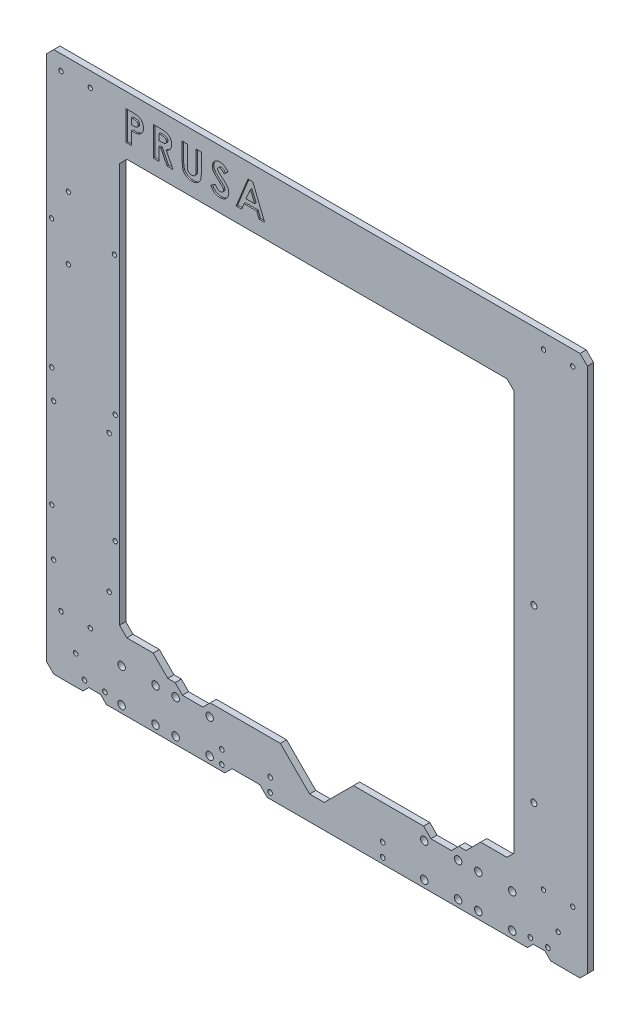
from build123d import *

# Parameters (mm, degrees)
SKETCH1_R           = 2.55
SKETCH1_R_2         = 1.5
SKETCH1_R_3         = 1.6
SKETCH1_R_4         = 2.1
BOSS_EXTRUDE1_DEPTH = 4.25
CUT_EXTRUDE1_DEPTH  = 1


with BuildPart() as part:
    # Sketch1 → Boss-Extrude1 (new body)
    with BuildSketch(Plane.XY):
        with BuildLine():
            add(Edge.make_bspline(
                [(5, 370), (2.5, 367.5), (0, 365)],
                knots=[1472.868668236, 1472.868668236, 1472.868668236, 1479.939736048, 1479.939736048, 1479.939736048], degree=2))
            add(Edge.make_bspline(
                [(0, 365), (0, 185), (0, 5)],
                knots=[0, 0, 0, 360.191742, 360.191742, 360.191742], degree=2))
            add(Edge.make_bspline(
                [(0, 5), (2.5, 2.5), (5, 0)],
                knots=[360.191742, 360.191742, 360.191742, 367.128552866, 367.128552866, 367.128552866], degree=2))
            add(Edge.make_bspline(
                [(5, 0), (15, 0), (25, 0)],
                knots=[367.128552866, 367.128552866, 367.128552866, 387.128552866, 387.128552866, 387.128552866], degree=2))
            add(Edge.make_bspline(
                [(25, 0), (27, 2), (29, 4)],
                knots=[387.128552866, 387.128552866, 387.128552866, 395.613834241, 395.613834241, 395.613834241], degree=2))
            add(Edge.make_bspline(
                [(29, 4), (33, 4), (37, 4)],
                knots=[395.613834241, 395.613834241, 395.613834241, 401.613834241, 401.613834241, 401.613834241], degree=2))
            add(Edge.make_bspline(
                [(37, 4), (39, 2), (41, 0)],
                knots=[401.613834241, 401.613834241, 401.613834241, 407.27068849, 407.27068849, 407.27068849], degree=2))
            add(Edge.make_bspline(
                [(41, 0), (81.5, 0), (122, 0)],
                knots=[407.27068849, 407.27068849, 407.27068849, 482.27068849, 482.27068849, 482.27068849], degree=2))
            add(Edge.make_bspline(
                [(122, 0), (124.5, 2.5), (127, 5)],
                knots=[482.27068849, 482.27068849, 482.27068849, 487.92754274, 487.92754274, 487.92754274], degree=2))
            add(Edge.make_bspline(
                [(127, 5), (136.5, 5), (146, 5)],
                knots=[487.92754274, 487.92754274, 487.92754274, 501.92754274, 501.92754274, 501.92754274], degree=2))
            add(Edge.make_bspline(
                [(146, 5), (148.5, 2.5), (151, 0)],
                knots=[501.92754274, 501.92754274, 501.92754274, 507.584396989, 507.584396989, 507.584396989], degree=2))
            add(Edge.make_bspline(
                [(151, 0), (240, 0), (329, 0)],
                knots=[507.584396989, 507.584396989, 507.584396989, 698.584396989, 698.584396989, 698.584396989], degree=2))
            add(Edge.make_bspline(
                [(329, 0), (331, 2), (333, 4)],
                knots=[698.584396989, 698.584396989, 698.584396989, 704.241251238, 704.241251238, 704.241251238], degree=2))
            add(Edge.make_bspline(
                [(333, 4), (337, 4), (341, 4)],
                knots=[704.241251238, 704.241251238, 704.241251238, 710.241251238, 710.241251238, 710.241251238], degree=2))
            add(Edge.make_bspline(
                [(341, 4), (343, 2), (345, 0)],
                knots=[710.241251238, 710.241251238, 710.241251238, 718.726532613, 718.726532613, 718.726532613], degree=2))
            add(Edge.make_bspline(
                [(345, 0), (355, 0), (365, 0)],
                knots=[718.726532613, 718.726532613, 718.726532613, 738.726532613, 738.726532613, 738.726532613], degree=2))
            add(Edge.make_bspline(
                [(365, 0), (367.5, 2.5), (370, 5)],
                knots=[738.726532613, 738.726532613, 738.726532613, 745.797600425, 745.797600425, 745.797600425], degree=2))
            add(Edge.make_bspline(
                [(370, 5), (370, 185), (370, 365)],
                knots=[745.797600425, 745.797600425, 745.797600425, 1105.797600425, 1105.797600425, 1105.797600425], degree=2))
            add(Edge.make_bspline(
                [(370, 365), (367.5, 367.5), (365, 370)],
                knots=[1105.797600425, 1105.797600425, 1105.797600425, 1112.868668236, 1112.868668236, 1112.868668236], degree=2))
            add(Edge.make_bspline(
                [(365, 370), (185, 370), (5, 370)],
                knots=[1112.868668236, 1112.868668236, 1112.868668236, 1472.868668236, 1472.868668236, 1472.868668236], degree=2))
        make_face()
        with Locations((318.6, 4.9)):
            Circle(SKETCH1_R, mode=Mode.SUBTRACT)
        with Locations((318.6, 28.1)):
            Circle(SKETCH1_R, mode=Mode.SUBTRACT)
        with Locations((295.4, 28.1)):
            Circle(SKETCH1_R, mode=Mode.SUBTRACT)
        with Locations((295.4, 4.9)):
            Circle(SKETCH1_R, mode=Mode.SUBTRACT)
        with Locations((281.6, 4.9)):
            Circle(SKETCH1_R, mode=Mode.SUBTRACT)
        with Locations((258.4, 4.9)):
            Circle(SKETCH1_R, mode=Mode.SUBTRACT)
        with Locations((258.4, 28.1)):
            Circle(SKETCH1_R, mode=Mode.SUBTRACT)
        with Locations((281.6, 28.1)):
            Circle(SKETCH1_R, mode=Mode.SUBTRACT)
        with Locations((111.6, 4.9)):
            Circle(SKETCH1_R, mode=Mode.SUBTRACT)
        with Locations((111.6, 28.1)):
            Circle(SKETCH1_R, mode=Mode.SUBTRACT)
        with Locations((88.4, 28.1)):
            Circle(SKETCH1_R, mode=Mode.SUBTRACT)
        with Locations((88.4, 4.9)):
            Circle(SKETCH1_R, mode=Mode.SUBTRACT)
        with Locations((74.6, 4.9)):
            Circle(SKETCH1_R, mode=Mode.SUBTRACT)
        with Locations((74.6, 28.1)):
            Circle(SKETCH1_R, mode=Mode.SUBTRACT)
        with Locations((51.4, 28.1)):
            Circle(SKETCH1_R, mode=Mode.SUBTRACT)
        with Locations((51.4, 4.9)):
            Circle(SKETCH1_R, mode=Mode.SUBTRACT)
        with Locations((360, 39.8)):
            Circle(SKETCH1_R_2, mode=Mode.SUBTRACT)
        with Locations((10, 39.8)):
            Circle(SKETCH1_R_2, mode=Mode.SUBTRACT)
        with Locations((340, 359.8)):
            Circle(SKETCH1_R_2, mode=Mode.SUBTRACT)
        with Locations((30, 39.8)):
            Circle(SKETCH1_R_2, mode=Mode.SUBTRACT)
        with Locations((42.9, 67.8)):
            Circle(SKETCH1_R_2, mode=Mode.SUBTRACT)
        with Locations((340, 39.8)):
            Circle(SKETCH1_R_2, mode=Mode.SUBTRACT)
        with Locations((10, 359.8)):
            Circle(SKETCH1_R_2, mode=Mode.SUBTRACT)
        with Locations((350, 19.8)):
            Circle(SKETCH1_R_2, mode=Mode.SUBTRACT)
        with Locations((47, 99.8)):
            Circle(SKETCH1_R_2, mode=Mode.SUBTRACT)
        with Locations((3.7, 181.1)):
            Circle(SKETCH1_R_2, mode=Mode.SUBTRACT)
        with Locations((20, 19.8)):
            Circle(SKETCH1_R_2, mode=Mode.SUBTRACT)
        with Locations((4.9, 67.8)):
            Circle(SKETCH1_R_2, mode=Mode.SUBTRACT)
        with Locations((360, 359.8)):
            Circle(SKETCH1_R_2, mode=Mode.SUBTRACT)
        with Locations((42.9, 161.8)):
            Circle(SKETCH1_R_2, mode=Mode.SUBTRACT)
        with Locations((3.7, 99.8)):
            Circle(SKETCH1_R_2, mode=Mode.SUBTRACT)
        with Locations((30, 359.8)):
            Circle(SKETCH1_R_2, mode=Mode.SUBTRACT)
        with Locations((47, 174.7)):
            Circle(SKETCH1_R_2, mode=Mode.SUBTRACT)
        with Locations((4.9, 161.8)):
            Circle(SKETCH1_R_2, mode=Mode.SUBTRACT)
        with Locations((46.5, 269.3)):
            Circle(SKETCH1_R_2, mode=Mode.SUBTRACT)
        with Locations((15, 247.8)):
            Circle(SKETCH1_R_2, mode=Mode.SUBTRACT)
        with Locations((3.5, 269.3)):
            Circle(SKETCH1_R_2, mode=Mode.SUBTRACT)
        with Locations((15, 290.8)):
            Circle(SKETCH1_R_2, mode=Mode.SUBTRACT)
        with Locations((40, 7)):
            Circle(SKETCH1_R_3, mode=Mode.SUBTRACT)
        with Locations((331, 7)):
            Circle(SKETCH1_R_3, mode=Mode.SUBTRACT)
        with Locations((343, 7)):
            Circle(SKETCH1_R_3, mode=Mode.SUBTRACT)
        with Locations((120, 13)):
            Circle(SKETCH1_R_3, mode=Mode.SUBTRACT)
        with Locations((120, 4)):
            Circle(SKETCH1_R_3, mode=Mode.SUBTRACT)
        with Locations((230, 13)):
            Circle(SKETCH1_R_3, mode=Mode.SUBTRACT)
        with Locations((230, 4)):
            Circle(SKETCH1_R_3, mode=Mode.SUBTRACT)
        with Locations((333.4, 205)):
            Circle(SKETCH1_R_4, mode=Mode.SUBTRACT)
        with Locations((333.4, 88)):
            Circle(SKETCH1_R_4, mode=Mode.SUBTRACT)
        with Locations((26, 7)):
            Circle(SKETCH1_R_3, mode=Mode.SUBTRACT)
        with Locations((153, 13)):
            Circle(SKETCH1_R_3, mode=Mode.SUBTRACT)
        with Locations((153, 4)):
            Circle(SKETCH1_R_3, mode=Mode.SUBTRACT)
        with BuildLine():
            add(Edge.make_bspline(
                [(93, 31.5), (100, 31.5), (107, 31.5)],
                knots=[1110.421356237, 1110.421356237, 1110.421356237, 1117.046356237, 1117.046356237, 1117.046356237], degree=2))
            add(Edge.make_bspline(
                [(107, 31.5), (109.5, 34), (112, 36.5)],
                knots=[0, 0, 0, 7.071067812, 7.071067812, 7.071067812], degree=2))
            add(Edge.make_bspline(
                [(112, 36.5), (134.25, 36.5), (156.5, 36.5), (158.25, 36.5), (160, 36.5)],
                knots=[7.071067812, 7.071067812, 7.071067812, 51.571067812, 51.571067812, 55.071067812, 55.071067812, 55.071067812], degree=2))
            add(Edge.make_bspline(
                [(160, 36.5), (170, 26.5), (180, 16.5)],
                knots=[55.071067812, 55.071067812, 55.071067812, 83.355339059, 83.355339059, 83.355339059], degree=2))
            add(Edge.make_bspline(
                [(180, 16.5), (185, 16.5), (190, 16.5)],
                knots=[83.355339059, 83.355339059, 83.355339059, 93.355339059, 93.355339059, 93.355339059], degree=2))
            add(Edge.make_bspline(
                [(190, 16.5), (200, 26.5), (210, 36.5)],
                knots=[93.355339059, 93.355339059, 93.355339059, 121.639610307, 121.639610307, 121.639610307], degree=2))
            add(Edge.make_bspline(
                [(210, 36.5), (211.75, 36.5), (213.5, 36.5), (235.75, 36.5), (258, 36.5)],
                knots=[121.639610307, 121.639610307, 121.639610307, 125.139610307, 125.139610307, 169.639610307, 169.639610307, 169.639610307], degree=2))
            add(Edge.make_bspline(
                [(258, 36.5), (260.5, 34), (263, 31.5)],
                knots=[169.639610307, 169.639610307, 169.639610307, 176.710678119, 176.710678119, 176.710678119], degree=2))
            add(Edge.make_bspline(
                [(263, 31.5), (264, 31.5), (265, 31.5), (270, 31.5), (275, 31.5), (276, 31.5), (277, 31.5)],
                knots=[176.710678119, 176.710678119, 176.710678119, 178.710678119, 178.710678119, 188.710678119, 188.710678119, 190.710678119, 190.710678119, 190.710678119], degree=2))
            add(Edge.make_bspline(
                [(277, 31.5), (279.5, 34), (282, 36.5)],
                knots=[190.710678119, 190.710678119, 190.710678119, 197.781745931, 197.781745931, 197.781745931], degree=2))
            add(Edge.make_bspline(
                [(282, 36.5), (284.5, 36.5), (287, 36.5)],
                knots=[197.781745931, 197.781745931, 197.781745931, 202.781745931, 202.781745931, 202.781745931], degree=2))
            add(Edge.make_bspline(
                [(287, 36.5), (292, 41.5), (297, 46.5)],
                knots=[202.781745931, 202.781745931, 202.781745931, 216.923881554, 216.923881554, 216.923881554], degree=2))
            add(Edge.make_bspline(
                [(297, 46.5), (306, 46.5), (315, 46.5)],
                knots=[216.923881554, 216.923881554, 216.923881554, 234.923881554, 234.923881554, 234.923881554], degree=2))
            add(Edge.make_bspline(
                [(315, 46.5), (317.5, 49), (320, 51.5)],
                knots=[234.923881554, 234.923881554, 234.923881554, 241.994949366, 241.994949366, 241.994949366], degree=2))
            add(Edge.make_bspline(
                [(320, 51.5), (320, 188.25), (320, 325)],
                knots=[241.994949366, 241.994949366, 241.994949366, 513.494949366, 513.494949366, 513.494949366], degree=2))
            add(Edge.make_bspline(
                [(320, 325), (317.5, 327.5), (315, 330)],
                knots=[513.494949366, 513.494949366, 513.494949366, 520.566017178, 520.566017178, 520.566017178], degree=2))
            add(Edge.make_bspline(
                [(315, 330), (185, 330), (55, 330)],
                knots=[520.566017178, 520.566017178, 520.566017178, 780.566017178, 780.566017178, 780.566017178], degree=2))
            add(Edge.make_bspline(
                [(55, 330), (52.5, 327.5), (50, 325)],
                knots=[780.566017178, 780.566017178, 780.566017178, 787.63708499, 787.63708499, 787.63708499], degree=2))
            add(Edge.make_bspline(
                [(50, 325), (50, 188.25), (50, 51.5)],
                knots=[787.63708499, 787.63708499, 787.63708499, 1059.13708499, 1059.13708499, 1059.13708499], degree=2))
            add(Edge.make_bspline(
                [(50, 51.5), (52.5, 49), (55, 46.5)],
                knots=[1059.13708499, 1059.13708499, 1059.13708499, 1066.208152802, 1066.208152802, 1066.208152802], degree=2))
            add(Edge.make_bspline(
                [(55, 46.5), (64, 46.5), (73, 46.5)],
                knots=[1066.208152802, 1066.208152802, 1066.208152802, 1084.208152802, 1084.208152802, 1084.208152802], degree=2))
            add(Edge.make_bspline(
                [(73, 46.5), (78, 41.5), (83, 36.5)],
                knots=[1084.208152802, 1084.208152802, 1084.208152802, 1098.350288425, 1098.350288425, 1098.350288425], degree=2))
            add(Edge.make_bspline(
                [(83, 36.5), (85.5, 36.5), (88, 36.5)],
                knots=[1098.350288425, 1098.350288425, 1098.350288425, 1103.350288425, 1103.350288425, 1103.350288425], degree=2))
            add(Edge.make_bspline(
                [(88, 36.5), (90.5, 34), (93, 31.5)],
                knots=[1103.350288425, 1103.350288425, 1103.350288425, 1110.421356237, 1110.421356237, 1110.421356237], degree=2))
        make_face(mode=Mode.SUBTRACT)
    extrude(amount=BOSS_EXTRUDE1_DEPTH)

    # Sketch2 → Cut-Extrude1 (cut)
    # profile 1 of 5: a face of its own
    with BuildSketch(Plane.XY.offset(4.25)):
        with BuildLine():
            Line((54.564407773, 359.746059065), (58.57081803, 359.746059065))
            add(Edge.make_bspline(
                [(58.57081803, 359.746059065), (58.832591679, 359.744887311), (59.337607918, 359.742626751), (60.065882885, 359.715214451), (60.7377522, 359.666089942), (61.353061503, 359.605379816), (61.911557793, 359.520266583), (62.413940476, 359.422690925), (62.860313807, 359.303815374), (63.25571131, 359.162711743), (63.610567798, 358.996356076), (63.946376486, 358.819175415), (64.255548063, 358.607716545), (64.553687352, 358.384769606), (64.823749214, 358.129036561), (65.082581726, 357.857536815), (65.319222626, 357.559502914), (65.534768419, 357.238542475), (65.730301665, 356.900585477), (65.901132591, 356.545027751), (66.039701071, 356.171306666), (66.155942795, 355.781839771), (66.249309281, 355.376644041), (66.311456986, 354.953227485), (66.353670833, 354.51454656), (66.357395623, 354.215980045), (66.359279568, 354.064969322)],
                knots=[0, 0, 0, 0, 1.698747864, 3.27724071, 4.728299578, 6.070144658, 7.288476769, 8.393259625, 9.389771311, 10.283485332, 11.113357557, 11.931608583, 12.74405601, 13.541433047, 14.344816069, 15.154114104, 15.974336324, 16.810834471, 17.661136416, 18.50621059, 19.367396281, 20.244825668, 21.142564693, 22.063065223, 23.020325768, 24, 24, 24, 24], degree=3))
            add(Edge.make_bspline(
                [(66.359279568, 354.064969322), (66.356553735, 353.897909754), (66.351197137, 353.569617176), (66.298685215, 353.088380532), (66.208978262, 352.629564962), (66.091735966, 352.189301194), (65.928249922, 351.774832541), (65.741474794, 351.376269654), (65.511682144, 351.004787013), (65.249107305, 350.655737818), (64.962345625, 350.326284134), (64.644589394, 350.025938314), (64.301895182, 349.752652909), (63.936246724, 349.503563869), (63.546271266, 349.27917366), (63.132250194, 349.077381106), (62.691356337, 348.904640161), (62.38433112, 348.814298045), (62.228670594, 348.768494963)],
                knots=[0, 0, 0, 0, 1.102006807, 2.165578795, 3.188629044, 4.184801286, 5.166646146, 6.124351954, 7.085497154, 8.042432466, 9.003981491, 9.963833307, 10.922997304, 11.89326795, 12.880200226, 13.889073926, 14.929769137, 16, 16, 16, 16], degree=3))
            add(Edge.make_bspline(
                [(62.228670594, 348.768494963), (62.126143617, 348.742986085), (61.90403717, 348.687725642), (61.536512005, 348.631622422), (61.112977841, 348.58003896), (60.632065114, 348.53570922), (60.093496568, 348.505575326), (59.497793676, 348.482042095), (58.844686477, 348.464931006), (58.390541557, 348.464323829), (58.154151363, 348.464007783)],
                knots=[0, 0, 0, 0, 0.618981996, 1.340914327, 2.176866532, 3.120127938, 4.170906482, 5.338178032, 6.614476169, 8, 8, 8, 8], degree=3))
            Line((58.154151363, 348.464007783), (58.154151363, 339.746059065))
            Line((58.154151363, 339.746059065), (54.564407773, 339.746059065))
            Line((54.564407773, 339.746059065), (54.564407773, 359.746059065))
        make_face()
        with BuildLine():
            Line((58.154151363, 352.053751373), (59.424183414, 352.053751373))
            add(Edge.make_bspline(
                [(59.424183414, 352.053751373), (59.655285797, 352.055216742), (60.080517614, 352.057913041), (60.661234114, 352.096903103), (61.127909063, 352.156448804), (61.496590939, 352.241851109), (61.787700201, 352.371460415), (62.038763713, 352.521393976), (62.254107297, 352.710980848), (62.440563146, 352.927616288), (62.589628978, 353.176541267), (62.692998368, 353.453702524), (62.760145092, 353.753276605), (62.766346715, 353.961760337), (62.769535979, 354.068975732)],
                knots=[0, 0, 0, 0, 1.8619151, 3.425951444, 4.686033666, 5.651700536, 6.461346321, 7.243864085, 7.999046032, 8.762387399, 9.539336099, 10.322741239, 11.137448474, 12, 12, 12, 12], degree=3))
            add(Edge.make_bspline(
                [(62.769535979, 354.068975732), (62.766379521, 354.162648427), (62.760255235, 354.344395977), (62.71526456, 354.606702771), (62.643562367, 354.851226815), (62.539668645, 355.075414379), (62.405358664, 355.278884532), (62.241607617, 355.46155712), (62.050516752, 355.62734423), (61.902983431, 355.71509788), (61.828029568, 355.75968086)],
                knots=[0, 0, 0, 0, 1.102301479, 2.1387299, 3.123554645, 4.094223062, 5.036071848, 5.982632524, 6.975082478, 8, 8, 8, 8], degree=3))
            add(Edge.make_bspline(
                [(61.828029568, 355.75968086), (61.76453932, 355.791789699), (61.630117453, 355.859770692), (61.401183982, 355.938803566), (61.136998252, 356.005476502), (60.835776712, 356.060814395), (60.498721021, 356.103762347), (60.125891316, 356.136606786), (59.716738942, 356.149814814), (59.432197947, 356.154088822), (59.283959055, 356.156315476)],
                knots=[0, 0, 0, 0, 0.656809284, 1.390599849, 2.23162475, 3.173112763, 4.218524733, 5.370385145, 6.63003504, 8, 8, 8, 8], degree=3))
            Line((59.283959055, 356.156315476), (58.154151363, 356.156315476))
            Line((58.154151363, 356.156315476), (58.154151363, 352.053751373))
        make_face(mode=Mode.SUBTRACT)
    # profile 2 of 5: a face of its own
    with BuildSketch(Plane.XY.offset(4.25)):
        with BuildLine():
            Line((73.333638543, 359.746059065), (77.51633085, 359.746059065))
            add(Edge.make_bspline(
                [(77.51633085, 359.746059065), (77.792805539, 359.745077739), (78.324544243, 359.743190372), (79.091282412, 359.713412716), (79.795636864, 359.671974665), (80.438650459, 359.608739098), (81.020048106, 359.52489638), (81.5404125, 359.42605969), (81.999728433, 359.313414092), (82.4018696, 359.173048789), (82.764782117, 359.014718855), (83.103067038, 358.832794858), (83.424187431, 358.629302579), (83.725996952, 358.398887586), (84.011118397, 358.145694986), (84.280089666, 357.869469917), (84.529109945, 357.567870105), (84.756637289, 357.242801277), (84.964010149, 356.900836323), (85.147284264, 356.541505726), (85.296323078, 356.164559592), (85.428014848, 355.77544561), (85.522868163, 355.368601318), (85.588837256, 354.947987415), (85.637137245, 354.512123294), (85.639914263, 354.216016563), (85.64133085, 354.064969322)],
                knots=[0, 0, 0, 0, 1.749336639, 3.364467119, 4.854658419, 6.213483162, 7.451590619, 8.570285859, 9.5643256, 10.440900261, 11.26203566, 12.067320669, 12.869050712, 13.665104639, 14.467235401, 15.27997916, 16.102287765, 16.939272006, 17.78853747, 18.631303466, 19.488103222, 20.351255419, 21.228522269, 22.127379805, 23.044756219, 24, 24, 24, 24], degree=3))
            add(Edge.make_bspline(
                [(85.64133085, 354.064969322), (85.637651066, 353.907310701), (85.630435681, 353.598170881), (85.591569689, 353.144069699), (85.520534866, 352.70961745), (85.412942291, 352.296086159), (85.289278601, 351.898328945), (85.124837616, 351.523684678), (84.939249711, 351.166704701), (84.718832378, 350.832438629), (84.476935124, 350.513461746), (84.195613706, 350.22199524), (83.89309343, 349.94237389), (83.552368531, 349.692112227), (83.188458477, 349.454288463), (82.794132761, 349.238756799), (82.371964885, 349.040099263), (82.075159962, 348.929314099), (81.923382132, 348.872661629)],
                knots=[0, 0, 0, 0, 1.099860209, 2.156625411, 3.176576793, 4.16617041, 5.135385252, 6.078461593, 7.016046972, 7.938469504, 8.868247731, 9.803980173, 10.76021508, 11.73834243, 12.748633912, 13.790971185, 14.870363756, 16, 16, 16, 16], degree=3))
            Line((81.923382132, 348.872661629), (86.538766748, 339.746059065))
            Line((86.538766748, 339.746059065), (82.548382132, 339.746059065))
            Line((82.548382132, 339.746059065), (78.14133085, 348.464007783))
            Line((78.14133085, 348.464007783), (76.923382132, 348.464007783))
            Line((76.923382132, 348.464007783), (76.923382132, 339.746059065))
            Line((76.923382132, 339.746059065), (73.333638543, 339.746059065))
            Line((73.333638543, 339.746059065), (73.333638543, 359.746059065))
        make_face()
        with BuildLine():
            Line((76.923382132, 352.053751373), (78.321619312, 352.053751373))
            add(Edge.make_bspline(
                [(78.321619312, 352.053751373), (78.49256543, 352.055676683), (78.819890514, 352.059363238), (79.290626977, 352.076463009), (79.718167949, 352.117665007), (80.104349437, 352.169722191), (80.451114671, 352.229829728), (80.755370626, 352.315967477), (81.021805424, 352.408266257), (81.2472618, 352.522969697), (81.439886548, 352.653412386), (81.606205689, 352.801598525), (81.743775466, 352.973105111), (81.857002409, 353.163271335), (81.945080661, 353.373779172), (82.009371037, 353.602317722), (82.04529985, 353.851490333), (82.049433583, 354.023453362), (82.051587261, 354.113046245)],
                knots=[0, 0, 0, 0, 1.688639943, 3.233382647, 4.650958383, 5.928841754, 7.082724185, 8.122798841, 9.049171256, 9.863274652, 10.613301712, 11.341792392, 12.054588806, 12.776240173, 13.521029143, 14.301969904, 15.115324896, 16, 16, 16, 16], degree=3))
            add(Edge.make_bspline(
                [(82.051587261, 354.113046245), (82.047515535, 354.219041166), (82.039517385, 354.427248546), (81.960150885, 354.726994166), (81.833816561, 355.004429246), (81.660646805, 355.258300265), (81.442562011, 355.480861125), (81.192292504, 355.677050296), (80.904436863, 355.832182013), (80.637904201, 355.934505241), (80.395421778, 355.995726285), (80.176589042, 356.041347665), (79.923179415, 356.073680846), (79.635001589, 356.10797594), (79.312790137, 356.130214573), (78.954788815, 356.146444342), (78.5620258, 356.153084738), (78.288232676, 356.155207556), (78.145337261, 356.156315476)],
                knots=[0, 0, 0, 0, 1.020303359, 2.004196876, 2.966617323, 3.9489082, 4.950758222, 5.960522915, 7.003732012, 8.091992268, 8.70421221, 9.413913587, 10.24622431, 11.166358409, 12.212345909, 13.359657661, 14.621978493, 16, 16, 16, 16], degree=3))
            Line((78.145337261, 356.156315476), (76.923382132, 356.156315476))
            Line((76.923382132, 356.156315476), (76.923382132, 352.053751373))
        make_face(mode=Mode.SUBTRACT)
    # profile 3 of 5: a face of its own
    with BuildSketch(Plane.XY.offset(4.25)):
        with BuildLine():
            Line((92.872100081, 359.746059065), (96.461843671, 359.746059065))
            Line((96.461843671, 359.746059065), (96.461843671, 346.733238553))
            add(Edge.make_bspline(
                [(96.461843671, 346.733238553), (96.462038863, 346.598327274), (96.462415876, 346.337747532), (96.481289313, 345.963900918), (96.498559809, 345.620257604), (96.529720687, 345.307193807), (96.575755984, 345.024575609), (96.620333172, 344.770587571), (96.680663989, 344.549777061), (96.771331561, 344.298436892), (96.911020527, 344.016042484), (97.139264545, 343.721724553), (97.402638617, 343.453116723), (97.718307612, 343.229537742), (98.073091645, 343.048682498), (98.465041336, 342.914688777), (98.893604176, 342.84020606), (99.189931871, 342.828834909), (99.342452645, 342.822982142)],
                knots=[0, 0, 0, 0, 1.155499968, 2.231836252, 3.205919964, 4.102923608, 4.924856345, 5.658536265, 6.31071849, 6.882491295, 7.94666036, 8.992281882, 10.060072772, 11.158554251, 12.289267114, 13.461410017, 14.693379945, 16, 16, 16, 16], degree=3))
            add(Edge.make_bspline(
                [(99.342452645, 342.822982142), (99.504487146, 342.827710426), (99.820426989, 342.836929779), (100.274856156, 342.927427711), (100.695887356, 343.071531411), (101.074605924, 343.277204116), (101.410634973, 343.523738898), (101.695076521, 343.804865807), (101.919556746, 344.12114555), (102.065864605, 344.412937697), (102.148009263, 344.681506959), (102.209580776, 344.921463403), (102.254719507, 345.204588255), (102.295670846, 345.52645991), (102.320279447, 345.890412337), (102.346963463, 346.293518585), (102.356743402, 346.738536815), (102.358410321, 347.04841136), (102.359279568, 347.210001373)],
                knots=[0, 0, 0, 0, 1.261321664, 2.459363699, 3.594844139, 4.716940403, 5.803436589, 6.833651888, 7.818396249, 8.814403945, 9.360733334, 10.004355033, 10.743453831, 11.592799886, 12.532235708, 13.585170094, 14.740740724, 16, 16, 16, 16], degree=3))
            Line((102.359279568, 347.210001373), (102.359279568, 359.746059065))
            Line((102.359279568, 359.746059065), (105.949023158, 359.746059065))
            Line((105.949023158, 359.746059065), (105.949023158, 347.814969322))
            add(Edge.make_bspline(
                [(105.949023158, 347.814969322), (105.948524657, 347.573246014), (105.947566088, 347.108435667), (105.932845357, 346.440470489), (105.901507583, 345.830391445), (105.875187467, 345.278020272), (105.82424903, 344.784101105), (105.771183129, 344.346524768), (105.703546072, 343.966841933), (105.602906198, 343.534619167), (105.429231569, 343.036930481), (105.149245299, 342.463863533), (104.793820852, 341.902796279), (104.373726917, 341.359900846), (103.899402437, 340.855568484), (103.381364202, 340.41282995), (102.827842551, 340.038320892), (102.233053579, 339.741198508), (101.597503483, 339.509465448), (100.914903968, 339.353752504), (100.185720513, 339.248550884), (99.682059719, 339.238444974), (99.42258085, 339.233238553)],
                knots=[0, 0, 0, 0, 1.170808336, 2.251350247, 3.235597562, 4.129743112, 4.929140599, 5.639994148, 6.264258765, 6.79612947, 7.788252245, 8.809469599, 9.879094798, 10.999557536, 12.129761673, 13.226370002, 14.293821979, 15.358369427, 16.438775801, 17.562147481, 18.744053101, 20, 20, 20, 20], degree=3))
            add(Edge.make_bspline(
                [(99.42258085, 339.233238553), (99.250177928, 339.236142452), (98.910030499, 339.241871786), (98.409784033, 339.292389548), (97.926197556, 339.366833734), (97.460179723, 339.475440135), (97.010113075, 339.61573932), (96.576117182, 339.788437846), (96.15980488, 339.992572422), (95.763505792, 340.226265453), (95.387707599, 340.478964236), (95.044247449, 340.759091475), (94.721306072, 341.045930702), (94.428213109, 341.351553329), (94.162767172, 341.672750841), (93.925514947, 342.010251176), (93.716808911, 342.364024355), (93.531399179, 342.74044712), (93.372706544, 343.158651682), (93.238922692, 343.633513747), (93.12204597, 344.172476306), (93.035190086, 344.776753612), (92.956446032, 345.444354034), (92.906605388, 346.177016774), (92.880531503, 346.974762852), (92.874981571, 347.52782367), (92.872100081, 347.814969322)],
                knots=[0, 0, 0, 0, 1.001158378, 1.975264943, 2.917723546, 3.841610987, 4.75185031, 5.653588123, 6.552117133, 7.442167995, 8.324307438, 9.179605724, 10.014504199, 10.831958861, 11.636465792, 12.43274043, 13.225645099, 14.020104002, 14.867201867, 15.819789774, 16.883317127, 18.068162734, 19.364263498, 20.787406516, 22.332041935, 24, 24, 24, 24], degree=3))
            Line((92.872100081, 347.814969322), (92.872100081, 359.746059065))
        make_face()
    # profile 4 of 5: a face of its own
    with BuildSketch(Plane.XY.offset(4.25)):
        with BuildLine():
            Line((124.205433414, 357.073783424), (121.521138543, 354.617853937))
            add(Edge.make_bspline(
                [(121.521138543, 354.617853937), (121.40615486, 354.780050375), (121.185402225, 355.091444916), (120.827585229, 355.508409547), (120.47138396, 355.864111406), (120.11349843, 356.157064538), (119.750756478, 356.385489032), (119.383787771, 356.547216098), (119.014672757, 356.650027528), (118.766684445, 356.662830025), (118.644535979, 356.669135988)],
                knots=[0, 0, 0, 0, 1.299362458, 2.494594718, 3.587462134, 4.587049575, 5.512617175, 6.380583204, 7.202344345, 8, 8, 8, 8], degree=3))
            add(Edge.make_bspline(
                [(118.644535979, 356.669135988), (118.530599392, 356.66514024), (118.310617779, 356.657425501), (117.997017669, 356.580741564), (117.718599026, 356.448396351), (117.475633573, 356.275343851), (117.283169087, 356.066855708), (117.129501121, 355.848205253), (117.042973143, 355.6068646), (117.031584359, 355.441102103), (117.025946235, 355.359039835)],
                knots=[0, 0, 0, 0, 1.185010067, 2.2879431, 3.333075148, 4.379039566, 5.372662701, 6.27520591, 7.14612461, 8, 8, 8, 8], degree=3))
            add(Edge.make_bspline(
                [(117.025946235, 355.359039835), (117.029479361, 355.275794191), (117.036594587, 355.108149035), (117.10531798, 354.862444179), (117.208903757, 354.622361933), (117.307884196, 354.476212446), (117.358478286, 354.401507783)],
                knots=[0, 0, 0, 0, 0.967525499, 1.948461899, 2.951351359, 4, 4, 4, 4], degree=3))
            add(Edge.make_bspline(
                [(117.358478286, 354.401507783), (117.404473787, 354.343440631), (117.510349355, 354.209777715), (117.712232379, 353.998076491), (117.965755057, 353.738723962), (118.280673478, 353.4406385), (118.64391451, 353.093099786), (119.072314845, 352.709769701), (119.553543253, 352.278776956), (119.895589256, 351.978649215), (120.07482444, 351.821379578)],
                knots=[0, 0, 0, 0, 0.473873513, 1.090794244, 1.870441696, 2.795289791, 3.865433203, 5.087734844, 6.473946851, 8, 8, 8, 8], degree=3))
            add(Edge.make_bspline(
                [(120.07482444, 351.821379578), (120.243062443, 351.675778073), (120.562343219, 351.399456666), (121.016616361, 351.007262794), (121.415846794, 350.654415531), (121.765850394, 350.346210358), (122.06132145, 350.079413498), (122.303502121, 349.852749665), (122.495350235, 349.670631587), (122.604404654, 349.560632157), (122.650946235, 349.513687271)],
                knots=[0, 0, 0, 0, 1.543621617, 2.929473131, 4.163658386, 5.240097082, 6.164993805, 6.925417477, 7.541396219, 8, 8, 8, 8], degree=3))
            add(Edge.make_bspline(
                [(122.650946235, 349.513687271), (122.827515289, 349.322601738), (123.16694302, 348.955268239), (123.608079413, 348.38601684), (123.971148934, 347.830311401), (124.2520264, 347.277695424), (124.46415636, 346.72019576), (124.613710792, 346.14413976), (124.703279936, 345.543508), (124.713224202, 345.133650147), (124.718253927, 344.926347527)],
                knots=[0, 0, 0, 0, 1.206664779, 2.319633467, 3.337109185, 4.282041471, 5.190008762, 6.099243693, 7.03861361, 8, 8, 8, 8], degree=3))
            add(Edge.make_bspline(
                [(124.718253927, 344.926347527), (124.714673898, 344.724356547), (124.707649746, 344.328042728), (124.621617359, 343.748096486), (124.498940226, 343.193062762), (124.309259855, 342.668981108), (124.078078544, 342.167248884), (123.78825938, 341.695681482), (123.447906513, 341.249506447), (123.057809868, 340.836699704), (122.626316657, 340.462106197), (122.16349918, 340.128634209), (121.664831774, 339.853310607), (121.134574976, 339.626601259), (120.573012619, 339.451986688), (119.980813694, 339.322930246), (119.357072392, 339.245472604), (118.930549102, 339.237375326), (118.712644953, 339.233238553)],
                knots=[0, 0, 0, 0, 1.043214005, 2.046824704, 3.02475056, 3.976699089, 4.921714032, 5.875962561, 6.831408892, 7.817874052, 8.806269674, 9.781291748, 10.760897367, 11.74438705, 12.757449933, 13.795994037, 14.874007457, 16, 16, 16, 16], degree=3))
            add(Edge.make_bspline(
                [(118.712644953, 339.233238553), (118.541592051, 339.236273145), (118.202809207, 339.242283378), (117.703494513, 339.291351931), (117.221349732, 339.370543354), (116.756917956, 339.48404832), (116.308106838, 339.627874506), (115.874897947, 339.803552683), (115.460281867, 340.013805797), (115.061121416, 340.254310207), (114.679357007, 340.533567507), (114.310161379, 340.845868373), (113.957201733, 341.196016133), (113.618782876, 341.583182699), (113.297070106, 342.008464436), (112.98153261, 342.465938507), (112.686193823, 342.96409501), (112.503749917, 343.313555827), (112.41056162, 343.492052655)],
                knots=[0, 0, 0, 0, 1.016823716, 2.013894106, 2.979844003, 3.91962641, 4.853723003, 5.779685073, 6.695824784, 7.614987388, 8.547259901, 9.504950863, 10.487499108, 11.500346958, 12.559593716, 13.656357062, 14.802919212, 16, 16, 16, 16], degree=3))
            Line((112.41056162, 343.492052655), (115.567612902, 345.387084706))
            add(Edge.make_bspline(
                [(115.567612902, 345.387084706), (115.684177534, 345.184467485), (115.907641896, 344.796032954), (116.286323149, 344.274121931), (116.67426276, 343.827191532), (117.080429546, 343.46314128), (117.49988467, 343.177103356), (117.934654199, 342.972680811), (118.385043593, 342.846143487), (118.691828387, 342.830690357), (118.844856491, 342.822982142)],
                knots=[0, 0, 0, 0, 1.283663364, 2.460892379, 3.537111102, 4.529833553, 5.449777664, 6.316464042, 7.160231139, 8, 8, 8, 8], degree=3))
            add(Edge.make_bspline(
                [(118.844856491, 342.822982142), (119.000507982, 342.829277089), (119.302494545, 342.841490201), (119.733541718, 342.954299042), (120.128742088, 343.131417198), (120.470350369, 343.384140382), (120.759602723, 343.675821348), (120.973087564, 344.000329759), (121.10720018, 344.351440026), (121.121379136, 344.595344313), (121.128510338, 344.718014194)],
                knots=[0, 0, 0, 0, 1.13588714, 2.203786484, 3.234766741, 4.283437687, 5.291419208, 6.222934724, 7.106237994, 8, 8, 8, 8], degree=3))
            add(Edge.make_bspline(
                [(121.128510338, 344.718014194), (121.121924964, 344.832138555), (121.108547409, 345.063971271), (121.010012462, 345.408669239), (120.855972284, 345.753210446), (120.673731891, 346.035812465), (120.488279472, 346.272427476), (120.31094513, 346.477443678), (120.094998813, 346.703950691), (119.840988064, 346.952233441), (119.552269029, 347.224477626), (119.228598499, 347.520656586), (118.866270104, 347.838161338), (118.610175679, 348.054442438), (118.476266748, 348.167533424)],
                knots=[0, 0, 0, 0, 0.916159276, 1.861089862, 2.860218735, 3.940849679, 4.552606315, 5.27541173, 6.11797699, 7.06649574, 8.129236253, 9.306560635, 10.591630461, 12, 12, 12, 12], degree=3))
            add(Edge.make_bspline(
                [(118.476266748, 348.167533424), (118.22170054, 348.382920847), (117.733110935, 348.796314505), (117.042671836, 349.406883923), (116.420524386, 349.97751699), (115.872042119, 350.515267979), (115.390236523, 351.010205874), (114.978370595, 351.466350751), (114.640968869, 351.887221143), (114.285926305, 352.385713958), (113.948564884, 352.993161706), (113.65698888, 353.723991766), (113.467826676, 354.454729094), (113.446633682, 354.945305887), (113.436202645, 355.186764194)],
                knots=[0, 0, 0, 0, 1.345494975, 2.582412109, 3.71882943, 4.751509156, 5.681369928, 6.505683931, 7.230279997, 7.856715994, 8.973648664, 10.023341002, 11.027102913, 12, 12, 12, 12], degree=3))
            add(Edge.make_bspline(
                [(113.436202645, 355.186764194), (113.440540899, 355.357993464), (113.449087726, 355.695333521), (113.52532674, 356.191342922), (113.639268849, 356.669950318), (113.804745505, 357.129409531), (114.019514223, 357.569145069), (114.280342489, 357.991309624), (114.591280472, 358.392017687), (114.941686586, 358.771003618), (115.327744411, 359.117353631), (115.740296257, 359.423042221), (116.177007046, 359.68123125), (116.635205201, 359.895417797), (117.117729986, 360.059363992), (117.621026662, 360.175577227), (118.145817118, 360.244697153), (118.502768258, 360.254093205), (118.684600081, 360.258879578)],
                knots=[0, 0, 0, 0, 1.010766082, 1.991317756, 2.957454644, 3.913069143, 4.869106762, 5.843196583, 6.838735724, 7.860187025, 8.887984031, 9.89767229, 10.887916223, 11.879572884, 12.879850636, 13.892031539, 14.926195476, 16, 16, 16, 16], degree=3))
            add(Edge.make_bspline(
                [(118.684600081, 360.258879578), (118.920245125, 360.25025918), (119.389675112, 360.233086431), (120.083740888, 360.098801145), (120.761675319, 359.887623387), (121.307967589, 359.632860657), (121.742642151, 359.386071879), (122.075779599, 359.158859859), (122.414764883, 358.898576279), (122.762331711, 358.604400916), (123.112021751, 358.27079112), (123.473778365, 357.905688734), (123.842672176, 357.505938421), (124.082394664, 357.220358651), (124.205433414, 357.073783424)],
                knots=[0, 0, 0, 0, 1.282922637, 2.555718331, 3.837320111, 5.142675274, 5.830281639, 6.55870424, 7.337177975, 8.157850921, 9.037902056, 9.96903443, 10.957596896, 12, 12, 12, 12], degree=3))
        make_face()
    # profile 5 of 5: a face of its own
    with BuildSketch(Plane.XY.offset(4.25)):
        Polygon((137.850465466, 359.746059065), (141.179792389, 359.746059065), (149.256715466, 339.746059065), (145.42258085, 339.746059065), (143.868093671, 343.848623168), (135.154151363, 343.848623168), (133.599664184, 339.746059065), (129.769535979, 339.746059065), align=None)
        Polygon((139.513125722, 354.381475732), (136.51633085, 347.438366758), (142.509920594, 347.438366758), align=None, mode=Mode.SUBTRACT)
    extrude(amount=-CUT_EXTRUDE1_DEPTH, mode=Mode.SUBTRACT)


solid = part.part
